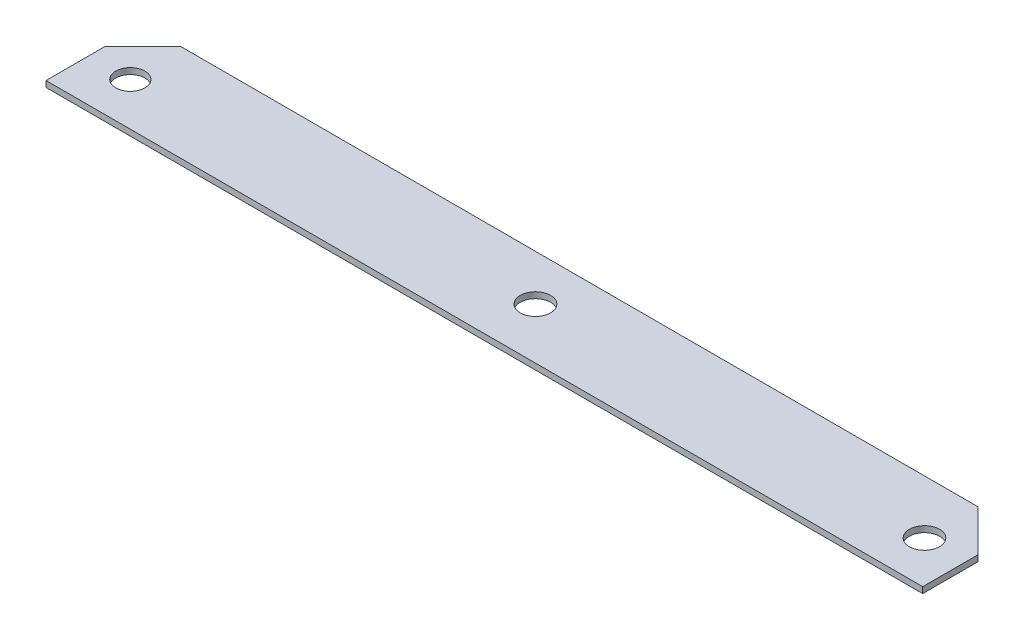
from build123d import *

# Parameters (mm, degrees)
SKETCH1_R           = 3.824987574
SKETCH1_R_2         = 3.960069723
SKETCH1_R_3         = 3.979490197
BOSS_EXTRUDE1_DEPTH = 1.5875


with BuildPart() as part:
    # Sketch1 → Boss-Extrude1 (new body)
    with BuildSketch(Plane(origin=(0, 0, 0), x_dir=(1, 0, 0), z_dir=(0, 1, 0))):
        Polygon((9.878524394, 25.4), (0, 15.521475606), (0, 0), (230, 0), (230, 14.509954572), (219.109954572, 25.4), align=None)
        with Locations(Location((10.82729629, 11.29561028, 0), (0, 0, 270))):
            Circle(SKETCH1_R, mode=Mode.SUBTRACT)
        with Locations(Location((219.17270371, 11.29561028, 0), (0, 0, 270))):
            Circle(SKETCH1_R_2, mode=Mode.SUBTRACT)
        with Locations(Location((115, 13.4, 0), (0, 0, 270))):
            Circle(SKETCH1_R_3, mode=Mode.SUBTRACT)
    extrude(amount=BOSS_EXTRUDE1_DEPTH)


solid = part.part
